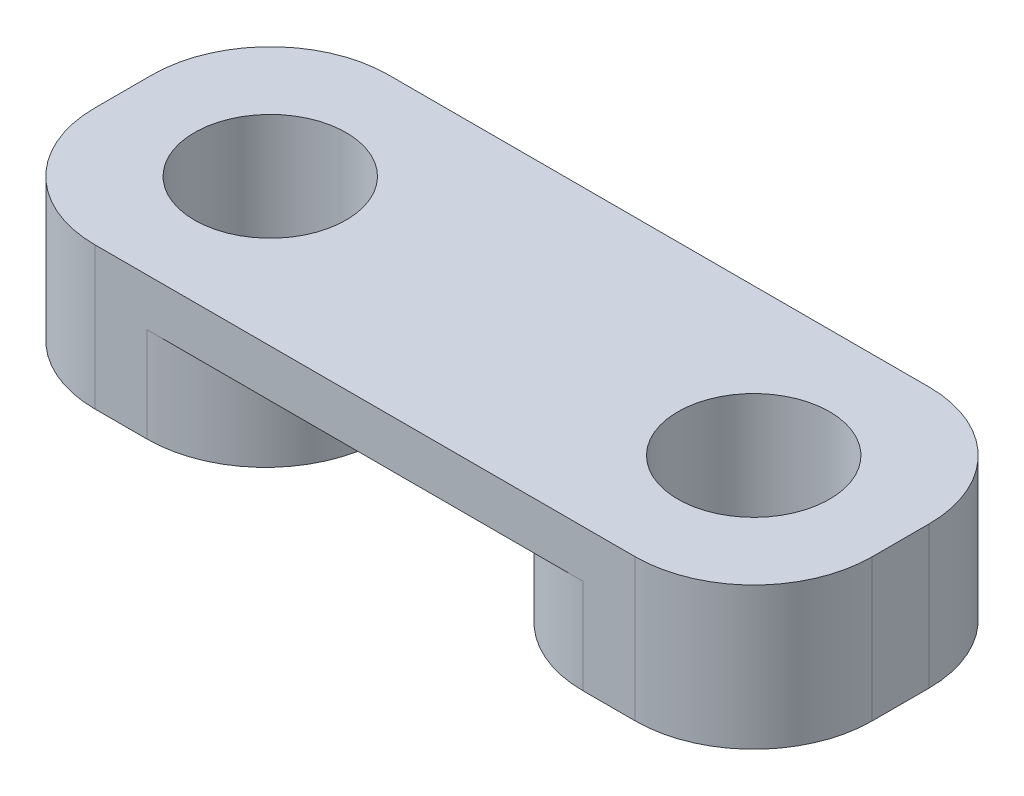
from build123d import *

# Parameters (mm, degrees)
SKETCH1_W           = 16.398039
SKETCH1_H           = 6.2
SKETCH1_R           = 1.6
BOSS_EXTRUDE1_DEPTH = 3
SKETCH5_W           = 4.198039
SKETCH5_H           = 2
CUT_EXTRUDE4_DEPTH  = 11.708124054
FILLET2_R           = 2.5


with BuildPart() as part:
    # Sketch1 → Boss-Extrude1 (new body)
    with BuildSketch(Plane(origin=(0, 0, 0), x_dir=(1, 0, 0), z_dir=(0, 1, 0))):
        with Locations((0, 3.1)):
            Rectangle(SKETCH1_W, SKETCH1_H)
        with Locations(Location((-5.0990195, 3.1, 0), (0, 0, 270))):
            Circle(SKETCH1_R, mode=Mode.SUBTRACT)
        with Locations(Location((5.0990195, 3.1, 0), (0, 0, 90))):
            Circle(SKETCH1_R, mode=Mode.SUBTRACT)
    extrude(amount=BOSS_EXTRUDE1_DEPTH)

    # Sketch5 → Cut-Extrude4 (cut, through all)
    with BuildSketch(Plane.XY):
        with Locations((0, 1)):
            Rectangle(SKETCH5_W, SKETCH5_H)
    extrude(amount=-CUT_EXTRUDE4_DEPTH, mode=Mode.SUBTRACT)

    # Fillet2
    fillet2_edges = [part.edges().sort_by_distance(p)[0] for p in [
        (-2.0990195, 1, -6.2),
        (2.0990195, 1, -6.2),
        (2.0990195, 1, 0),
        (-2.0990195, 1, 0),
        (-8.1990195, 1.5, -6.2),
        (8.1990195, 1.5, -6.2),
        (8.1990195, 1.5, 0),
        (-8.1990195, 1.5, 0),
    ]]
    fillet(fillet2_edges, radius=FILLET2_R)


solid = part.part
